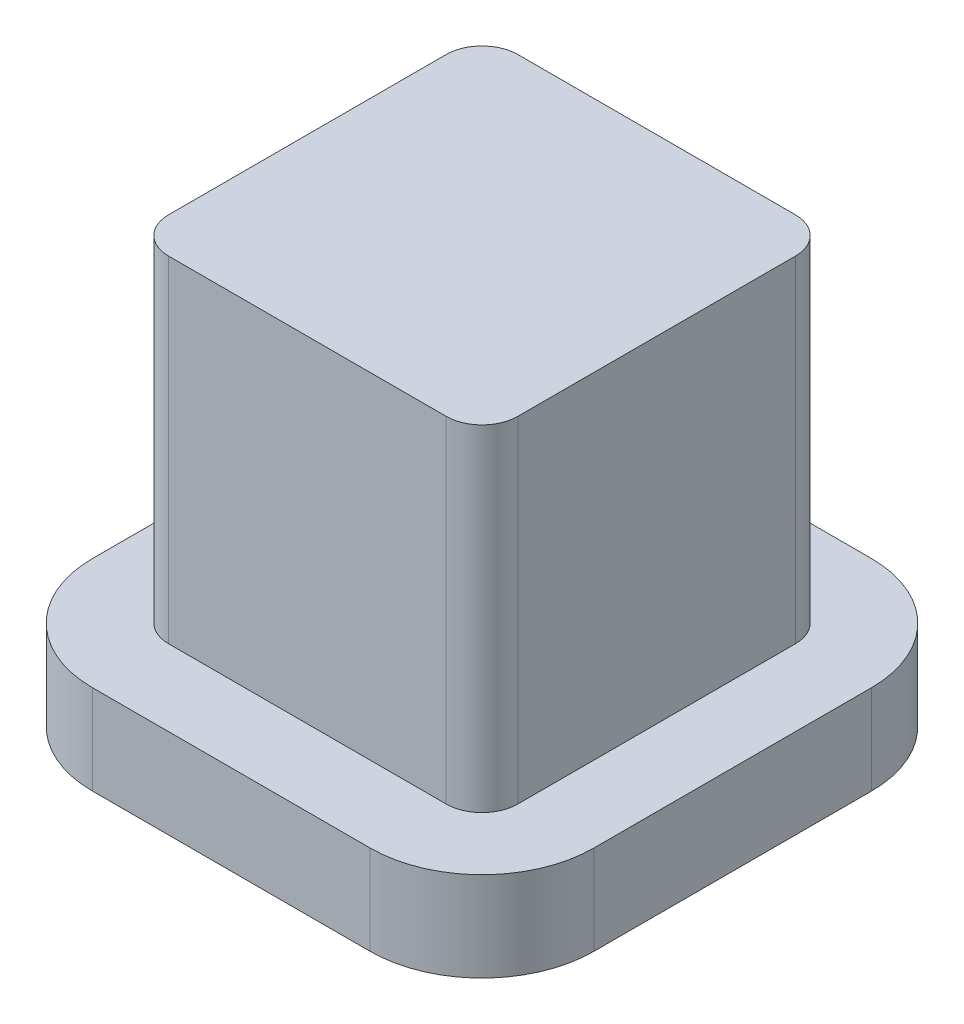
from build123d import *

# Parameters (mm, degrees)
BOSS_EXTRUDE1_START = 1
BOSS_EXTRUDE1_DEPTH = 7.5
BOSS_EXTRUDE2_DEPTH = 2
SKETCH3_W           = 6.2
SKETCH3_H           = 6.2
CUT_EXTRUDE1_DEPTH  = 4.4


with BuildPart() as part:
    # Sketch1 → Boss-Extrude1 (new body)
    with BuildSketch(Plane.XZ.offset(-123.724152422).offset(BOSS_EXTRUDE1_START)):
        with BuildLine():
            Line((80.976379089, 210.746126643), (80.976379089, 216.946126643))
            ThreePointArc((80.976379089, 216.946126643), (81.210693664, 217.511812068), (81.776379089, 217.746126643))
            Line((81.776379089, 217.746126643), (87.976379089, 217.746126643))
            ThreePointArc((87.976379089, 217.746126643), (88.542064514, 217.511812068), (88.776379089, 216.946126643))
            Line((88.776379089, 216.946126643), (88.776379089, 210.746126643))
            ThreePointArc((88.776379089, 210.746126643), (88.542064514, 210.180441218), (87.976379089, 209.946126643))
            Line((87.976379089, 209.946126643), (81.776379089, 209.946126643))
            ThreePointArc((81.776379089, 209.946126643), (81.210693664, 210.180441218), (80.976379089, 210.746126643))
        make_face()
    extrude(amount=-BOSS_EXTRUDE1_DEPTH)

    # Sketch2 → Boss-Extrude2 (add)
    with BuildSketch(Plane.XZ.offset(-122.724152422)):
        with BuildLine():
            Line((81.776379089, 208.246126643), (87.976379089, 208.246126643))
            ThreePointArc((87.976379089, 208.246126643), (89.744146042, 208.97835969), (90.476379089, 210.746126643))
            Line((90.476379089, 210.746126643), (90.476379089, 216.946126643))
            ThreePointArc((90.476379089, 216.946126643), (89.744146042, 218.713893596), (87.976379089, 219.446126643))
            Line((87.976379089, 219.446126643), (81.776379089, 219.446126643))
            ThreePointArc((81.776379089, 219.446126643), (80.008612136, 218.713893596), (79.276379089, 216.946126643))
            Line((79.276379089, 216.946126643), (79.276379089, 210.746126643))
            ThreePointArc((79.276379089, 210.746126643), (80.008612136, 208.97835969), (81.776379089, 208.246126643))
        make_face()
    extrude(amount=BOSS_EXTRUDE2_DEPTH)

    # Sketch3 → Cut-Extrude1 (cut)
    with BuildSketch(Plane.XZ.offset(-120.724152422)):
        with Locations((84.876379089, 213.846126643)):
            Rectangle(SKETCH3_W, SKETCH3_H)
    extrude(amount=-CUT_EXTRUDE1_DEPTH, mode=Mode.SUBTRACT)


solid = part.part
